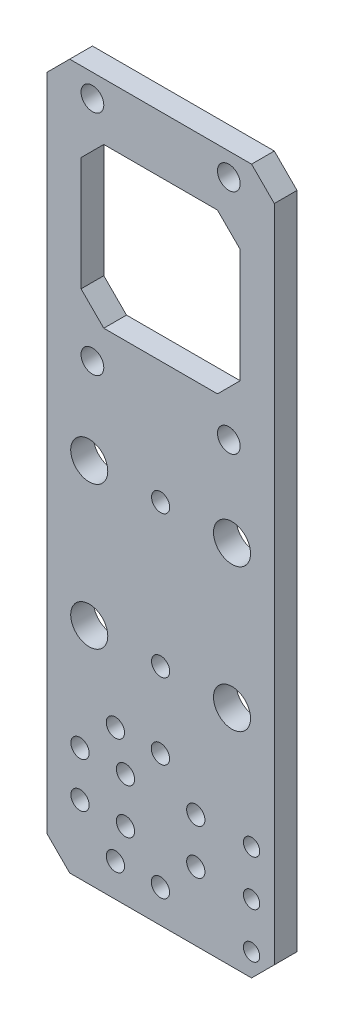
from build123d import *

# Parameters (mm, degrees)
SKETCH1_W                       = 63.5
SKETCH1_H                       = 196.85
BOSS_EXTRUDE1_DEPTH             = 3.175
SKETCH2_R                       = 2.54
SKETCH2_R_2                     = 5.175
CUT_EXTRUDE1_DEPTH              = 119.79762203
SKETCH3_W                       = 44.45
SKETCH3_H                       = 44.45
CUT_EXTRUDE2_DEPTH              = 119.79762203
SKETCH4_R                       = 3.175
CUT_EXTRUDE3_DEPTH              = 119.79762203
CHAMFER1_SIZE                   = 6.35
SKETCH5_R                       = 2.286
CUT_EXTRUDE4_DEPTH              = 119.79762203
F_10_CLEARANCE_HOLE1_AT_2_COUNT = 2
F_10_CLEARANCE_HOLE1_AT_2_PITCH = 13.97
F_10_CLEARANCE_HOLE1_AT_3_COUNT = 2
F_10_CLEARANCE_HOLE1_AT_3_PITCH = 34.687510721
F_10_CLEARANCE_HOLE1_AT_4_COUNT = 2
F_10_CLEARANCE_HOLE1_AT_4_PITCH = 31.75
SKETCH9_R                       = 2.5527
CUT_EXTRUDE6_DEPTH              = 119.79762203


with BuildPart() as part:
    # Sketch1 → Boss-Extrude1 (new, symmetric)
    with BuildSketch(Plane.XY):
        with Locations((0, 15.875)):
            Rectangle(SKETCH1_W, SKETCH1_H)
    extrude(amount=BOSS_EXTRUDE1_DEPTH, both=True)

    # Sketch2 → Cut-Extrude1 (cut, through all)
    with BuildSketch(Plane.XY.offset(3.175)):
        with Locations((0, 19.85)):
            Circle(SKETCH2_R)
        with Locations((0, -19.85)):
            Circle(SKETCH2_R)
        with Locations((-19.939, 19.939)):
            Circle(SKETCH2_R_2)
        with Locations((19.939, 19.939)):
            Circle(SKETCH2_R_2)
        with Locations((19.939, -19.939)):
            Circle(SKETCH2_R_2)
        with Locations((-19.939, -19.939)):
            Circle(SKETCH2_R_2)
    extrude(amount=-CUT_EXTRUDE1_DEPTH, mode=Mode.SUBTRACT)

    # Sketch3 → Cut-Extrude2 (cut, through all)
    with BuildSketch(Plane.XY.offset(3.175)):
        with Locations((0, 76.2)):
            Rectangle(SKETCH3_W, SKETCH3_H)
    extrude(amount=-CUT_EXTRUDE2_DEPTH, mode=Mode.SUBTRACT)

    # Sketch4 → Cut-Extrude3 (cut, through all)
    with BuildSketch(Plane.XY.offset(3.175)):
        with Locations((-19.05, 107.95)):
            Circle(SKETCH4_R)
        with Locations((19.05, 107.95)):
            Circle(SKETCH4_R)
        with Locations((19.05, 44.45)):
            Circle(SKETCH4_R)
        with Locations((-19.05, 44.45)):
            Circle(SKETCH4_R)
    extrude(amount=-CUT_EXTRUDE3_DEPTH, mode=Mode.SUBTRACT)

    # Chamfer1
    chamfer1_edges = [part.edges().sort_by_distance(p)[0] for p in [
        (31.75, -82.55, 0),
        (-31.75, -82.55, 0),
        (31.75, 114.3, 0),
        (-31.75, 114.3, 0),
        (-22.225, 53.975, 0),
        (22.225, 53.975, 0),
        (22.225, 98.425, 0),
        (-22.225, 98.425, 0),
    ]]
    chamfer(chamfer1_edges, length=CHAMFER1_SIZE)

    # Sketch5 → Cut-Extrude4 (cut, through all)
    with BuildSketch(Plane(origin=(0, 0, -3.175), x_dir=(-1, 0, 0), z_dir=(0, 0, -1))):
        with Locations((-25.4, -50.8)):
            Circle(SKETCH5_R)
        with Locations((-25.4, -63.5)):
            Circle(SKETCH5_R)
        with Locations((-25.4, -76.2)):
            Circle(SKETCH5_R)
    extrude(amount=-CUT_EXTRUDE4_DEPTH, mode=Mode.SUBTRACT)

    # Sketch8 → #10 Clearance Hole1 (revolve, cut)
    with BuildSketch(Plane(origin=(-22.514461018, -50.863820715, 3.175), x_dir=(0, -1, 0), z_dir=(1, 0, 0))):
        Polygon((0, 0), (0, 20.583816902), (2.5527, 19.05), (2.5527, 0), align=None)
    f_10_clearance_hole1 = revolve(axis=Axis((-22.514461018, -50.863820715, 9.525), (0, 0, -1)), mode=Mode.SUBTRACT)

    # #10 Clearance Hole1 at 2: #10 Clearance Hole1 ×2
    with Locations(*[Vector(0.7071067811865487, 0.7071067811865465, 0) * (i * F_10_CLEARANCE_HOLE1_AT_2_PITCH) for i in range(1, F_10_CLEARANCE_HOLE1_AT_2_COUNT)]):
        add(f_10_clearance_hole1, mode=Mode.SUBTRACT)

    # #10 Clearance Hole1 at 3: #10 Clearance Hole1 ×2
    with Locations(*[Vector(0.9320046715412955, -0.3624462611549497, 0) * (i * F_10_CLEARANCE_HOLE1_AT_3_PITCH) for i in range(1, F_10_CLEARANCE_HOLE1_AT_3_COUNT)]):
        add(f_10_clearance_hole1, mode=Mode.SUBTRACT)

    # #10 Clearance Hole1 at 4: #10 Clearance Hole1 ×2
    with Locations(*[Vector(0.7071067811865464, -0.7071067811865488, 0) * (i * F_10_CLEARANCE_HOLE1_AT_4_PITCH) for i in range(1, F_10_CLEARANCE_HOLE1_AT_4_COUNT)]):
        add(f_10_clearance_hole1, mode=Mode.SUBTRACT)

    # Mirror1: #10 Clearance Hole1 across plane
    add(f_10_clearance_hole1.mirror(Plane.ZY.offset(6.35)), mode=Mode.SUBTRACT)

    # Mirror1 copy 1 sketch → Mirror1 copy 1 (revolve, cut)
    with BuildSketch(Plane(origin=(-0.063820715, -40.985538982, 3.175), x_dir=(0, -1, 0), z_dir=(-1, 0, 0))):
        Polygon((0, 0), (0, -20.583816902), (2.5527, -19.05), (2.5527, 0), align=None)
    revolve(axis=Axis((-0.063820715, -40.985538982, 9.525), (0, 0, 1)), mode=Mode.SUBTRACT)

    # Mirror1 copy 2 sketch → Mirror1 copy 2 (revolve, cut)
    with BuildSketch(Plane(origin=(-22.514461018, -63.436179285, 3.175), x_dir=(0, -1, 0), z_dir=(-1, 0, 0))):
        Polygon((0, 0), (0, -20.583816902), (2.5527, -19.05), (2.5527, 0), align=None)
    revolve(axis=Axis((-22.514461018, -63.436179285, 9.525), (0, 0, 1)), mode=Mode.SUBTRACT)

    # Mirror1 copy 3 sketch → Mirror1 copy 3 (revolve, cut)
    with BuildSketch(Plane(origin=(-12.636179285, -73.314461018, 3.175), x_dir=(0, -1, 0), z_dir=(-1, 0, 0))):
        Polygon((0, 0), (0, -20.583816902), (2.5527, -19.05), (2.5527, 0), align=None)
    revolve(axis=Axis((-12.636179285, -73.314461018, 9.525), (0, 0, 1)), mode=Mode.SUBTRACT)

    # Sketch9 → Cut-Extrude6 (cut, through all)
    with BuildSketch(Plane.XY.offset(3.175)):
        with Locations((-9.814461018, -50.863820715)):
            Circle(SKETCH9_R)
        with Locations((-9.814461018, -63.436179285)):
            Circle(SKETCH9_R)
    extrude(amount=-CUT_EXTRUDE6_DEPTH, mode=Mode.SUBTRACT)


solid = part.part
